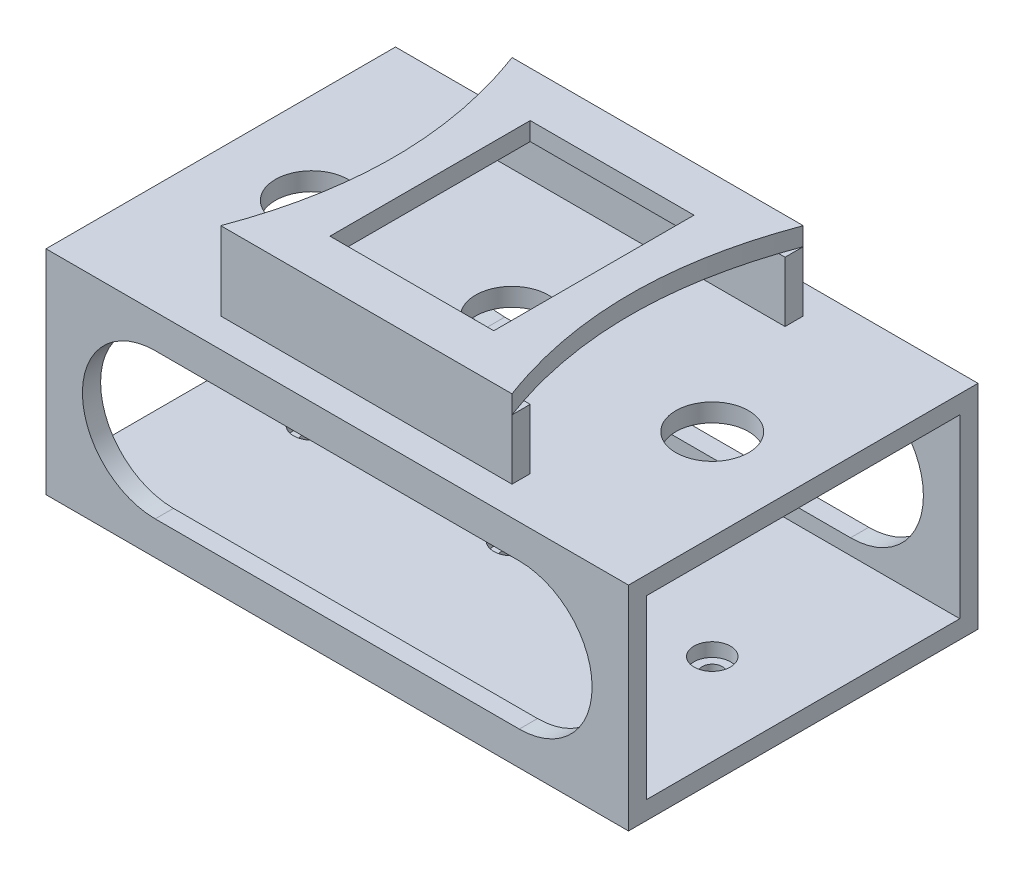
from build123d import *

# Parameters (mm, degrees)
SKETCH_12_W          = 64
SKETCH_12_H          = 38.4
EXTRUDE_2_DEPTH      = 23.4
SKETCH_13_W          = 34.4
SKETCH_13_H          = 19.4
CUT_EXTRUDE_10_DEPTH = 71.796892587
SKETCH_14_R          = 4
SKETCH_14_R_2        = 1.1
EXTRUDE_3_DEPTH      = 2
CUT_EXTRUDE_11_DEPTH = 56.191666038
CUT_EXTRUDE_13_REACH = 47.142
SKETCH_17_R          = 1.1
SKETCH_18_R          = 2
CUT_EXTRUDE_14_DEPTH = 1.5
SKETCH_20_W          = 32
SKETCH_20_H          = 32
EXTRUDE_5_DEPTH      = 8.6
SKETCH_21_W          = 28
SKETCH_21_H          = 6.6
CUT_EXTRUDE_16_DEPTH = 61.8
SKETCH_23_W          = 18
SKETCH_23_H          = 22
CUT_EXTRUDE_18_DEPTH = 2
SKETCH_22_R          = 4
CUT_EXTRUDE_17_DEPTH = 30


with BuildPart() as part:
    # 草图12 → 凸台-拉伸2 (new body)
    with BuildSketch(Plane(origin=(0, 0, 0), x_dir=(1, 0, 0), z_dir=(0, 1, 0))):
        Rectangle(SKETCH_12_W, SKETCH_12_H)
    extrude(amount=EXTRUDE_2_DEPTH)

    # 草图13 → 切除-拉伸10 (cut, through all)
    with BuildSketch(Plane(origin=(32, 0, 0), x_dir=(0, 0, -1), z_dir=(1, 0, 0))):
        with Locations((0, 11.7)):
            Rectangle(SKETCH_13_W, SKETCH_13_H)
    extrude(amount=-CUT_EXTRUDE_10_DEPTH, mode=Mode.SUBTRACT)

    # 草图14 → 凸台-拉伸3 (add)
    # profile 1 of 3: a face of its own
    with BuildSketch(Plane.XZ):
        with Locations(Location((-22, 0, 0), (0, 0, 90))):
            Circle(SKETCH_14_R)
        with Locations(Location((-22, 0, 0), (0, 0, 270))):
            Circle(SKETCH_14_R_2, mode=Mode.SUBTRACT)
    # profile 2 of 3: a face of its own
    with BuildSketch(Plane.XZ):
        with Locations(Location((22, 0, 0), (0, 0, 90))):
            Circle(SKETCH_14_R)
        with Locations(Location((22, 0, 0), (0, 0, 90))):
            Circle(SKETCH_14_R_2, mode=Mode.SUBTRACT)
    # profile 3 of 3: a face of its own
    with BuildSketch(Plane.XZ):
        with Locations(Location((0, 0, 0), (0, 0, 90))):
            Circle(SKETCH_14_R)
        with Locations(Location((0, 0, 0), (0, 0, 270))):
            Circle(SKETCH_14_R_2, mode=Mode.SUBTRACT)
    extrude(amount=EXTRUDE_3_DEPTH)

    # 草图15 → 切除-拉伸11 (cut, through all)
    with BuildSketch(Plane.XY.offset(19.2)):
        with BuildLine():
            Line((-20, 19.7), (20, 19.7))
            ThreePointArc((20, 19.7), (28, 11.7), (20, 3.7))
            Line((20, 3.7), (-20, 3.7))
            ThreePointArc((-20, 3.7), (-28, 11.7), (-20, 19.7))
        make_face()
    extrude(amount=-CUT_EXTRUDE_11_DEPTH, mode=Mode.SUBTRACT)

    # 草图17 → 切除-拉伸13 (cut, up to next)
    with BuildSketch(Plane.XZ.offset(2), mode=Mode.PRIVATE) as cut_extrude_13_sk1:
        with Locations(Location((22, 0, 0), (0, 0, 90))):
            Circle(SKETCH_17_R)
    cut_extrude_13_tool1 = extrude(cut_extrude_13_sk1.sketch, amount=-CUT_EXTRUDE_13_REACH, mode=Mode.PRIVATE) & part.part
    # 草图17 → 切除-拉伸13 (cut, up to next)
    with BuildSketch(Plane.XZ.offset(2), mode=Mode.PRIVATE) as cut_extrude_13_sk2:
        with Locations(Location((-22, 0, 0), (0, 0, 270))):
            Circle(SKETCH_17_R)
    cut_extrude_13_tool2 = extrude(cut_extrude_13_sk2.sketch, amount=-CUT_EXTRUDE_13_REACH, mode=Mode.PRIVATE) & part.part
    # 草图17 → 切除-拉伸13 (cut, up to next)
    with BuildSketch(Plane.XZ.offset(2), mode=Mode.PRIVATE) as cut_extrude_13_sk3:
        with Locations(Location((0, 0, 0), (0, 0, 270))):
            Circle(SKETCH_17_R)
    cut_extrude_13_tool3 = extrude(cut_extrude_13_sk3.sketch, amount=-CUT_EXTRUDE_13_REACH, mode=Mode.PRIVATE) & part.part
    add(cut_extrude_13_tool1.solids().sort_by_distance((22, -2, 0))[0], mode=Mode.SUBTRACT)
    add(cut_extrude_13_tool2.solids().sort_by_distance((-22, -2, 0))[0], mode=Mode.SUBTRACT)
    add(cut_extrude_13_tool3.solids().sort_by_distance((0, -2, 0))[0], mode=Mode.SUBTRACT)

    # 草图18 → 切除-拉伸14 (cut)
    with BuildSketch(Plane(origin=(0, 2, 0), x_dir=(1, 0, 0), z_dir=(0, 1, 0))):
        with Locations(Location((-22, 0, 0), (0, 0, 270))):
            Circle(SKETCH_18_R)
        with Locations(Location((22, 0, 0), (0, 0, 270))):
            Circle(SKETCH_18_R)
        with Locations(Location((0, 0, 0), (0, 0, 270))):
            Circle(SKETCH_18_R)
    extrude(amount=-CUT_EXTRUDE_14_DEPTH, mode=Mode.SUBTRACT)

    # 草图20 → 凸台-拉伸5 (add)
    with BuildSketch(Plane(origin=(0, 23.4, 0), x_dir=(1, 0, 0), z_dir=(0, 1, 0))):
        Rectangle(SKETCH_20_W, SKETCH_20_H)
    extrude(amount=EXTRUDE_5_DEPTH)

    # 草图21 → 切除-拉伸16 (cut, through all)
    with BuildSketch(Plane(origin=(16, 0, 0), x_dir=(0, 0, -1), z_dir=(1, 0, 0))):
        with Locations((0, 26.7)):
            Rectangle(SKETCH_21_W, SKETCH_21_H)
    extrude(amount=-CUT_EXTRUDE_16_DEPTH, mode=Mode.SUBTRACT)

    # 草图23 → 切除-拉伸18 (cut)
    with BuildSketch(Plane(origin=(0, 32, 0), x_dir=(1, 0, 0), z_dir=(0, 1, 0))):
        with BuildLine():
            Line((-16, 16), (-16, -16))
            add(Edge.make_bspline(
                [(-16, 16), (-10, 0), (-16, -16)],
                knots=[0, 0, 0, 1, 1, 1], degree=2))
        make_face()
        with BuildLine():
            Line((16, 16), (16, -16))
            add(Edge.make_bspline(
                [(16, 16), (10, 0), (16, -16)],
                knots=[0, 0, 0, 1, 1, 1], degree=2))
        make_face()
        Rectangle(SKETCH_23_W, SKETCH_23_H)
    extrude(amount=-CUT_EXTRUDE_18_DEPTH, mode=Mode.SUBTRACT)

    # 草图22 → 切除-拉伸17 (cut)
    with BuildSketch(Plane(origin=(0, 32, 0), x_dir=(1, 0, 0), z_dir=(0, 1, 0))):
        with Locations(Location((22, 0, 0), (0, 0, 270))):
            Circle(SKETCH_22_R)
        with Locations(Location((-22, 0, 0), (0, 0, 270))):
            Circle(SKETCH_22_R)
        with Locations(Location((0, 0, 0), (0, 0, 270))):
            Circle(SKETCH_22_R)
    extrude(amount=-CUT_EXTRUDE_17_DEPTH, mode=Mode.SUBTRACT)


solid = part.part
